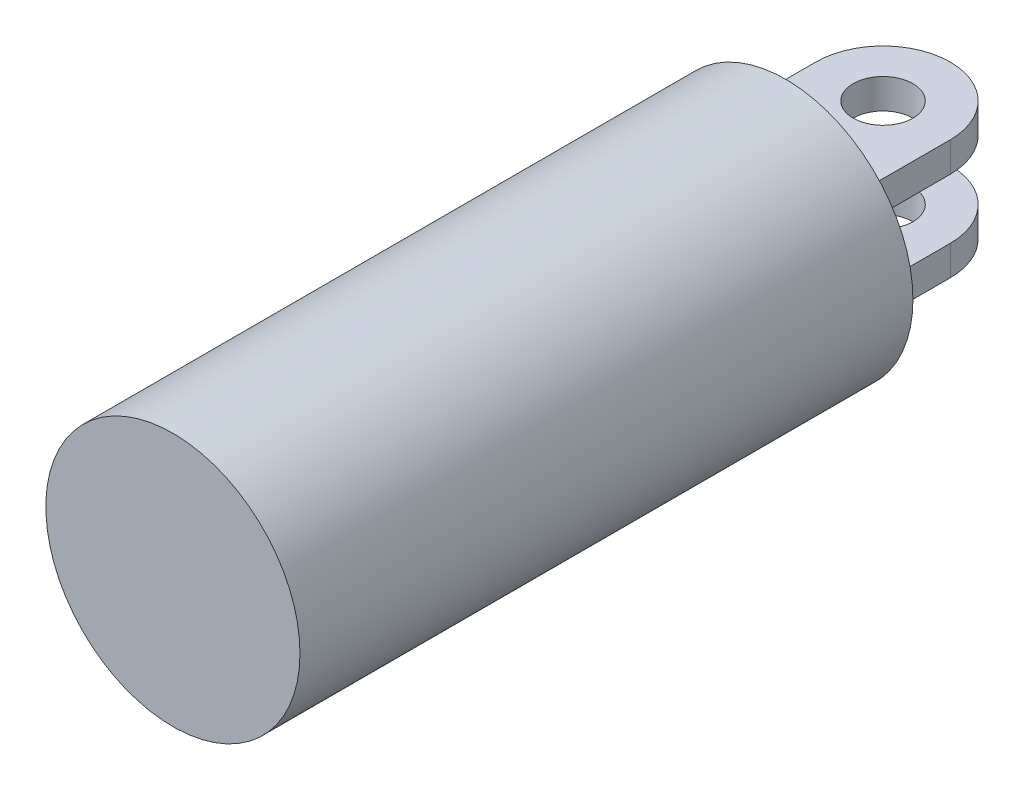
from build123d import *

# Parameters (mm, degrees)
SKETCH1_R          = 53.975
EXTRUDE1_DEPTH     = 260.35
SKETCH2_W          = 12.7
SKETCH2_H          = 69.85
EXTRUDE2_DEPTH     = 28.575
SKETCH3_R          = 12.7
CUT_EXTRUDE1_DEPTH = 278.481195309


with BuildPart() as part:
    # Sketch1 → Extrude1 (new body)
    with BuildSketch(Plane.XY):
        Circle(SKETCH1_R)
    extrude(amount=EXTRUDE1_DEPTH)

    # Sketch2 → Extrude2 (add, symmetric)
    with BuildSketch(Plane(origin=(0, 0, 0), x_dir=(0, -1, 0), z_dir=(1, 0, 0))):
        with Locations((-19.05, 34.925)):
            Rectangle(SKETCH2_W, SKETCH2_H)
        with Locations((19.05, 34.925)):
            Rectangle(SKETCH2_W, SKETCH2_H)
    extrude(amount=EXTRUDE2_DEPTH, both=True)

    # Sketch3 → Cut-Extrude1 (cut, through all)
    with BuildSketch(Plane(origin=(0, 25.4, 0), x_dir=(-1, 0, 0), z_dir=(0, 1, 0))):
        with Locations(Location((0, -41.275, 0), (0, 0, 90))):
            Circle(SKETCH3_R)
        with BuildLine():
            Line((-28.575, -41.275), (-28.575, -85.725))
            Line((-28.575, -85.725), (28.575, -85.725))
            Line((28.575, -85.725), (28.575, -41.275))
            ThreePointArc((28.575, -41.275), (0, -69.85), (-28.575, -41.275))
        make_face()
    extrude(amount=-CUT_EXTRUDE1_DEPTH, mode=Mode.SUBTRACT)


solid = part.part
